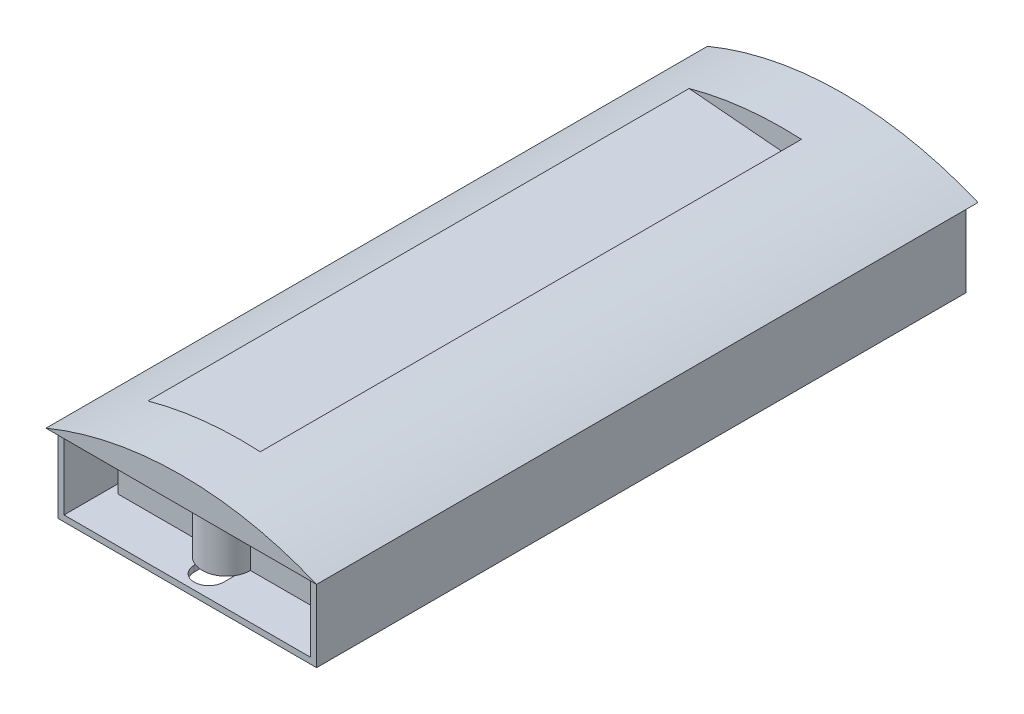
from build123d import *

# Parameters (mm, degrees)
EXTRUDE_1_DEPTH          = 110
SKETCH_2_W               = 14
SKETCH_2_H               = 95
SKETCH_2_W_2             = 8
EXTRUDE_2_DEPTH          = 11
SKETCH_3_R               = 1.6
CUT_EXTRUDE_1_DEPTH      = 11
SKETCH_4_W               = 43
SKETCH_4_H               = 108
EXTRUDE_3_DEPTH          = 1
SKETCH_5_W               = 1
SKETCH_5_H               = 12
EXTRUDE_4_DEPTH          = 108
CUT_EXTRUDE_2_DEPTH      = 45
CUT_EXTRUDE_2_DEPTH_BACK = 45


with BuildPart() as part:
    # 草图1 → 凸台-拉伸1 (new body)
    with BuildSketch(Plane.XY):
        with BuildLine():
            Line((0, 0), (45, 0))
            ThreePointArc((45, 0), (22.5, 4.5), (0, 0))
        make_face()
    extrude(amount=EXTRUDE_1_DEPTH)

    # 草图2 → 凸台-拉伸2 (add)
    with BuildSketch(Plane(origin=(0, 0, 0), x_dir=(-1, 0, 0), z_dir=(0, -1, 0))):
        with Locations((-11.5, -55)):
            Rectangle(SKETCH_2_W, SKETCH_2_H)
        with Locations((-22.5, -55)):
            Rectangle(SKETCH_2_W_2, SKETCH_2_H)
        with BuildLine():
            ThreePointArc((-26.5, -102.5), (-22.5, -106.5), (-18.5, -102.5))
            Line((-18.5, -102.5), (-26.5, -102.5))
        make_face()
        with Locations((-33.5, -55)):
            Rectangle(SKETCH_2_W, SKETCH_2_H)
        with BuildLine():
            Line((-26.5, -7.5), (-18.5, -7.5))
            ThreePointArc((-18.5, -7.5), (-22.5, -3.5), (-26.5, -7.5))
        make_face()
    extrude(amount=EXTRUDE_2_DEPTH)

    # 草图3 → 切除-拉伸1 (cut)
    with BuildSketch(Plane.XZ.offset(11)):
        with Locations(Location((22.5, 102.5, 0), (0, 0, 270))):
            Circle(SKETCH_3_R)
        with Locations(Location((22.5, 7.5, 0), (0, 0, 270))):
            Circle(SKETCH_3_R)
    extrude(amount=-CUT_EXTRUDE_1_DEPTH, mode=Mode.SUBTRACT)

    # 草图6 → 切除-拉伸2 (cut, two sides: drawn at the far end of the back side and taken through both)
    with BuildSketch(Plane(origin=(0, 0, 55), x_dir=(-1, 0, 0), z_dir=(0, 0, -1)).offset(-CUT_EXTRUDE_2_DEPTH_BACK)):
        with BuildLine():
            Line((-25.6355376, 4.415908826), (-28.879652294, 3.114923831))
            ThreePointArc((-28.879652294, 3.114923831), (-29.764951758, 1.806057322), (-28.879652294, 0.497190812))
            Line((-28.879652294, 0.497190812), (-5.388413498, 2.531348361))
            Line((-5.388413498, 2.531348361), (-21.708969166, 7.754187451))
            Line((-21.708969166, 7.754187451), (-25.6355376, 4.415908826))
        make_face()
    extrude(amount=CUT_EXTRUDE_2_DEPTH + CUT_EXTRUDE_2_DEPTH_BACK, mode=Mode.SUBTRACT)


with BuildPart() as body_2:
    # 草图4 → 凸台-拉伸3 (new body)
    with BuildSketch(Plane(origin=(0, -12, 0), x_dir=(-1, 0, 0), z_dir=(0, -1, 0))):
        with Locations((-22.5, -55)):
            Rectangle(SKETCH_4_W, SKETCH_4_H)
        with BuildLine():
            Line((-20.05, -4.6), (-20.05, -10.4))
            ThreePointArc((-20.05, -10.4), (-22.5, -12.85), (-24.95, -10.4))
            Line((-24.95, -10.4), (-24.95, -4.6))
            ThreePointArc((-24.95, -4.6), (-22.5, -2.15), (-20.05, -4.6))
        make_face(mode=Mode.SUBTRACT)
        with BuildLine():
            Line((-20.05, -105.4), (-20.05, -99.6))
            ThreePointArc((-20.05, -99.6), (-22.5, -97.15), (-24.95, -99.6))
            Line((-24.95, -99.6), (-24.95, -105.4))
            ThreePointArc((-24.95, -105.4), (-22.5, -107.85), (-20.05, -105.4))
        make_face(mode=Mode.SUBTRACT)
    extrude(amount=EXTRUDE_3_DEPTH)

    # 草图5 → 凸台-拉伸4 (add)
    with BuildSketch(Plane.XY.offset(109)):
        with Locations((1.5, -7)):
            Rectangle(SKETCH_5_W, SKETCH_5_H)
        with Locations((43.5, -7)):
            Rectangle(SKETCH_5_W, SKETCH_5_H)
    extrude(amount=-EXTRUDE_4_DEPTH)


solid = Compound([part.part, body_2.part])
